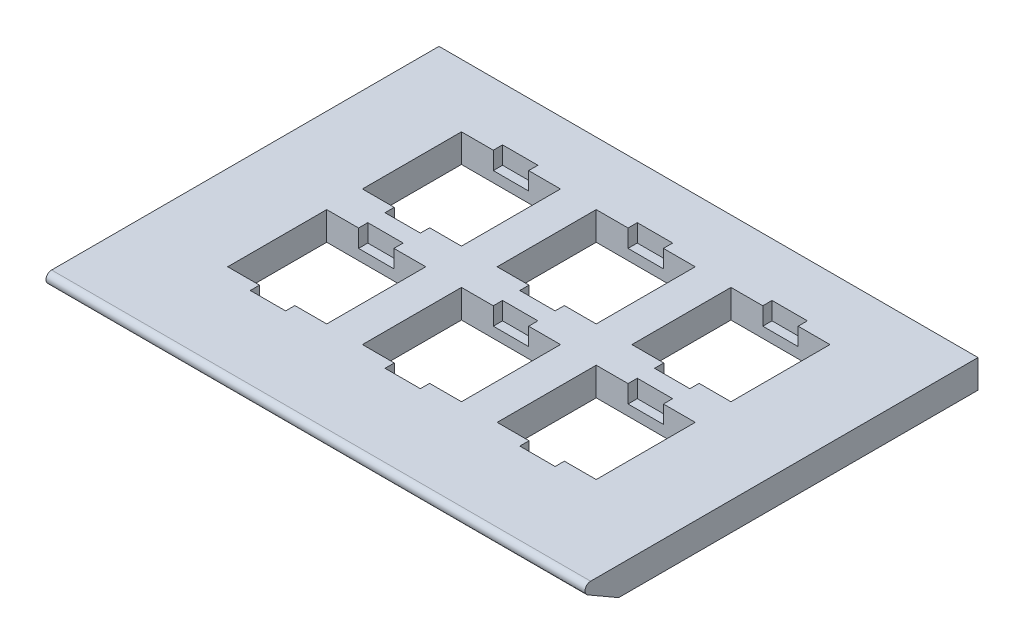
from build123d import *

# Parameters (mm, degrees)
SKETCH1_W            = 76.2
SKETCH1_H            = 50.8
BOSS_EXTRUDE1_DEPTH  = 1.999996
SKETCH2_W            = 13.999972
SKETCH2_H            = 13.999972
CUT_EXTRUDE1_DEPTH   = 92.668314788
SKETCH3_W            = 4.998974
SKETCH3_H            = 1.307084
CUT_EXTRUDE2_DEPTH   = 2.500122
LPATTERN1_COUNT      = 3
LPATTERN1_PITCH      = 19.048984
LPATTERN1_COUNT_DIR2 = 2
LPATTERN1_PITCH_DIR2 = 19.048984
BOSS_EXTRUDE2_DEPTH  = 76.2
FILLET1_R            = 0.79375


with BuildPart() as part:
    # Sketch1 → Boss-Extrude1 (new, symmetric)
    with BuildSketch(Plane(origin=(0, 0, 0), x_dir=(1, 0, 0), z_dir=(0, 1, 0))):
        with Locations((38.1, 25.4)):
            Rectangle(SKETCH1_W, SKETCH1_H)
    extrude(amount=BOSS_EXTRUDE1_DEPTH, both=True)

    # Sketch2 → Cut-Extrude1 (cut, symmetric)
    with BuildSketch(Plane(origin=(0, 1.999996, 0), x_dir=(1, 0, 0), z_dir=(0, 1, 0))):
        with Locations((19.051016, 34.924492)):
            Rectangle(SKETCH2_W, SKETCH2_H)
    cut_extrude1 = extrude(amount=CUT_EXTRUDE1_DEPTH, both=True, mode=Mode.SUBTRACT)

    # Sketch3 → Cut-Extrude2 (cut)
    with BuildSketch(Plane(origin=(0, 1.999996, 0), x_dir=(1, 0, 0), z_dir=(0, 1, 0))):
        with Locations((19.051016, 42.57802)):
            Rectangle(SKETCH3_W, SKETCH3_H)
        with Locations((19.051016, 27.270964)):
            Rectangle(SKETCH3_W, SKETCH3_H)
    cut_extrude2 = extrude(amount=-CUT_EXTRUDE2_DEPTH, mode=Mode.SUBTRACT)

    # LPattern1: Cut-Extrude1, Cut-Extrude2 3 × 2
    with Locations(*[(i * LPATTERN1_PITCH, 0, j * LPATTERN1_PITCH_DIR2) for i in range(LPATTERN1_COUNT) for j in range(LPATTERN1_COUNT_DIR2) if (i, j) != (0, 0)]):
        add(cut_extrude1, mode=Mode.SUBTRACT)
        add(cut_extrude2, mode=Mode.SUBTRACT)

    # Sketch4 → Boss-Extrude2 (add)
    with BuildSketch(Plane.ZY):
        Polygon((0, -1.999996), (6.928189374, 1.999996), (0, 1.999996), align=None)
    extrude(amount=-BOSS_EXTRUDE2_DEPTH)

    # Fillet1
    fillet1_edges = [part.edges().sort_by_distance(p)[0] for p in [
        (38.1, 1.999996, 6.928189374),
    ]]
    fillet(fillet1_edges, radius=FILLET1_R)


solid = part.part
